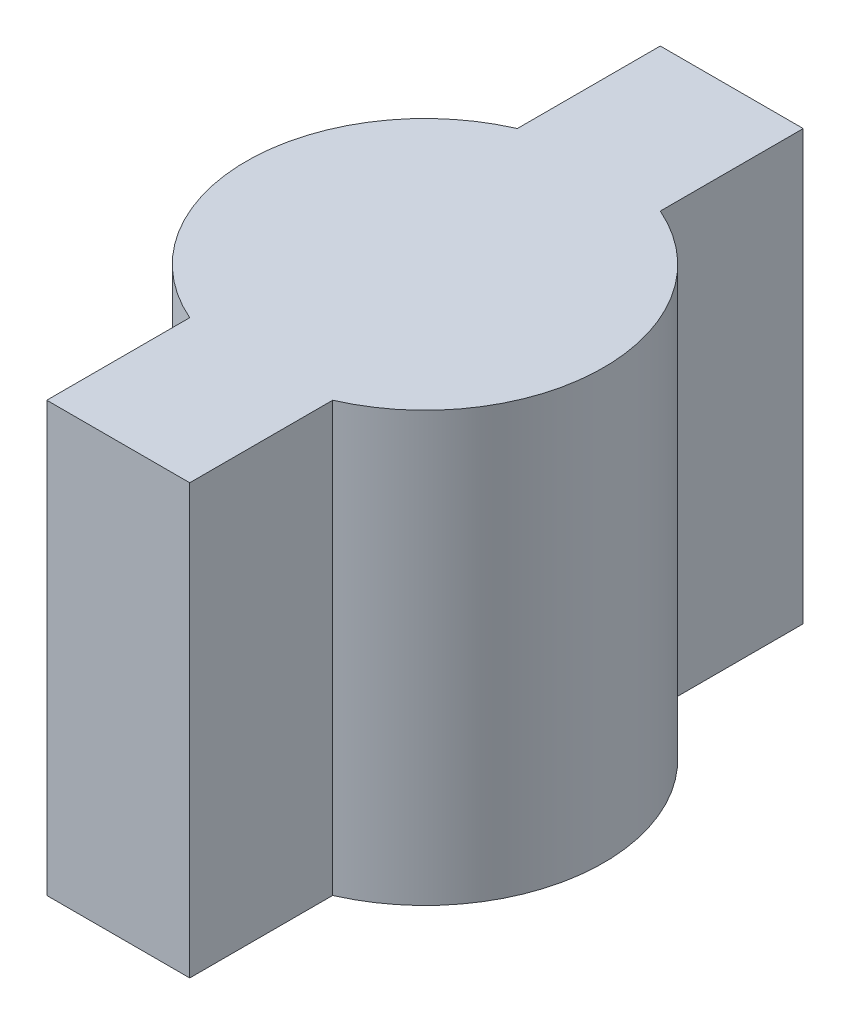
from build123d import *

# Parameters (mm, degrees)
BOSS_EXTRUDE1_DEPTH = 6
SKETCH3_R           = 2
CUT_EXTRUDE1_DEPTH  = 5


with BuildPart() as part:
    # Sketch1 → Boss-Extrude1 (new body)
    with BuildSketch(Plane(origin=(0, 0, 0), x_dir=(1, 0, 0), z_dir=(0, 1, 0))):
        with BuildLine():
            Line((-1, 2.291287847), (-1, 4.291287847))
            Line((-1, 4.291287847), (1, 4.291287847))
            Line((1, 4.291287847), (1, 2.291287847))
            ThreePointArc((1, 2.291287847), (2.5, 0), (1, -2.291287847))
            Line((1, -2.291287847), (1, -4.291287847))
            Line((1, -4.291287847), (-1, -4.291287847))
            Line((-1, -4.291287847), (-1, -2.291287847))
            ThreePointArc((-1, -2.291287847), (-2.5, 0), (-1, 2.291287847))
        make_face()
    extrude(amount=BOSS_EXTRUDE1_DEPTH)

    # Sketch3 → Cut-Extrude1 (cut)
    with BuildSketch(Plane.XZ):
        with Locations(Location((0, 0, 0), (0, 0, 270))):
            Circle(SKETCH3_R)
    extrude(amount=-CUT_EXTRUDE1_DEPTH, mode=Mode.SUBTRACT)


solid = part.part
